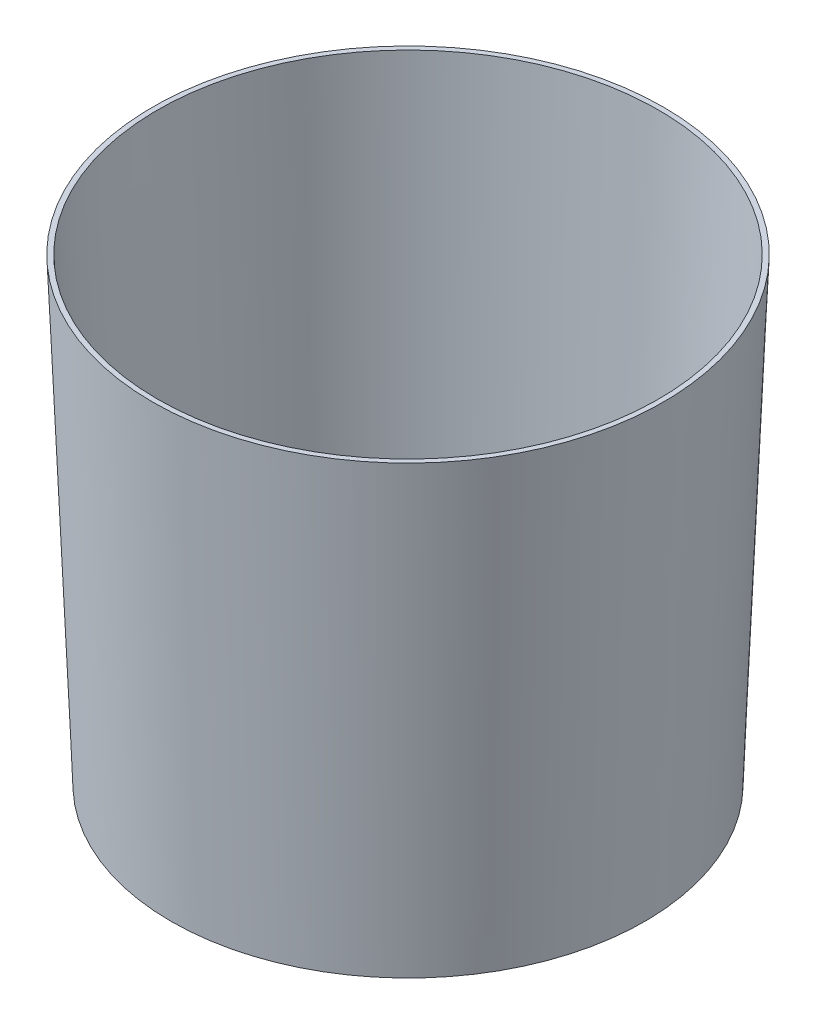
from build123d import *

# Parameters (mm, degrees)
SKETCH1_R = 96
SKETCH2_R = 103.5
SHELL1_T  = -2


with BuildPart() as part:
    # Sketch1 → Loft1 section 0
    with BuildSketch(Plane(origin=(0, 0, 0), x_dir=(1, 0, 0), z_dir=(0, 1, 0))):
        Circle(SKETCH1_R)
    # Sketch2 → Loft1 section 1
    with BuildSketch(Plane(origin=(0, 186, 0), x_dir=(1, 0, 0), z_dir=(0, 1, 0))):
        Circle(SKETCH2_R)
    loft()

    # Shell1
    shell1_openings = [part.faces().sort_by_distance(p)[0] for p in [
        (0, 186, 0),
    ]]
    offset(amount=SHELL1_T, openings=shell1_openings, kind=Kind.INTERSECTION)


solid = part.part
